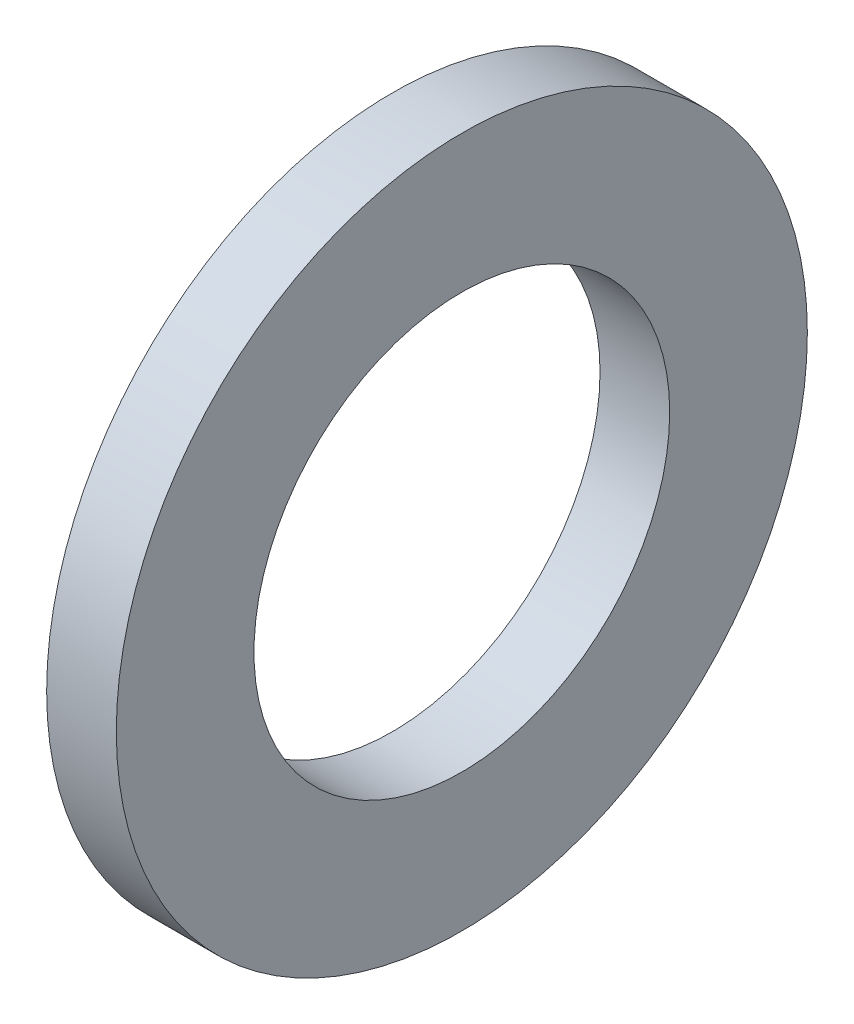
from build123d import *

# Parameters (mm, degrees)
SKETCH1_R      = 15.875
SKETCH1_R_2    = 9.5504
EXTRUDE1_DEPTH = 3.2004


with BuildPart() as part:
    # Sketch1 → Extrude1 (new body)
    with BuildSketch(Plane(origin=(0, 0, 0), x_dir=(0, 0, -1), z_dir=(1, 0, 0))):
        Circle(SKETCH1_R)
        Circle(SKETCH1_R_2, mode=Mode.SUBTRACT)
    extrude(amount=EXTRUDE1_DEPTH)


solid = part.part
